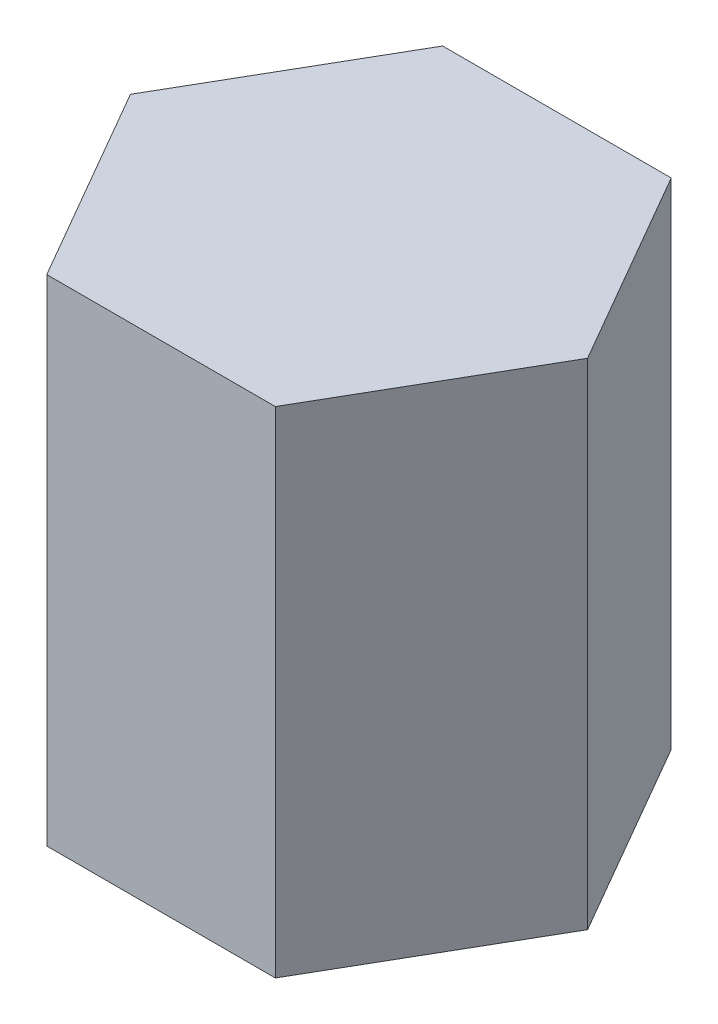
from build123d import *

# Parameters (mm, degrees)
SKETCH1_R           = 9.67
BOSS_EXTRUDE1_DEPTH = 50
BOSS_EXTRUDE2_START = -3
SKETCH2_R           = 9.67
BOSS_EXTRUDE2_DEPTH = 3


with BuildPart() as part:
    # Sketch1 → Boss-Extrude1 (new body)
    with BuildSketch(Plane(origin=(0, 0, 0), x_dir=(1, 0, 0), z_dir=(0, 1, 0))):
        Polygon((23.094010768, 0), (11.547005384, 20), (-11.547005384, 20), (-23.094010768, 0), (-11.547005384, -20), (11.547005384, -20), align=None)
        with Locations(Location((0, 0, 0), (0, 0, 270))):
            Circle(SKETCH1_R, mode=Mode.SUBTRACT)
    extrude(amount=BOSS_EXTRUDE1_DEPTH)

    # Sketch2 → Boss-Extrude2 (add)
    with BuildSketch(Plane(origin=(0, 50, 0), x_dir=(1, 0, 0), z_dir=(0, 1, 0)).offset(BOSS_EXTRUDE2_START)):
        with Locations(Location((0, 0, 0), (0, 0, 270))):
            Circle(SKETCH2_R)
    extrude(amount=BOSS_EXTRUDE2_DEPTH)


solid = part.part
